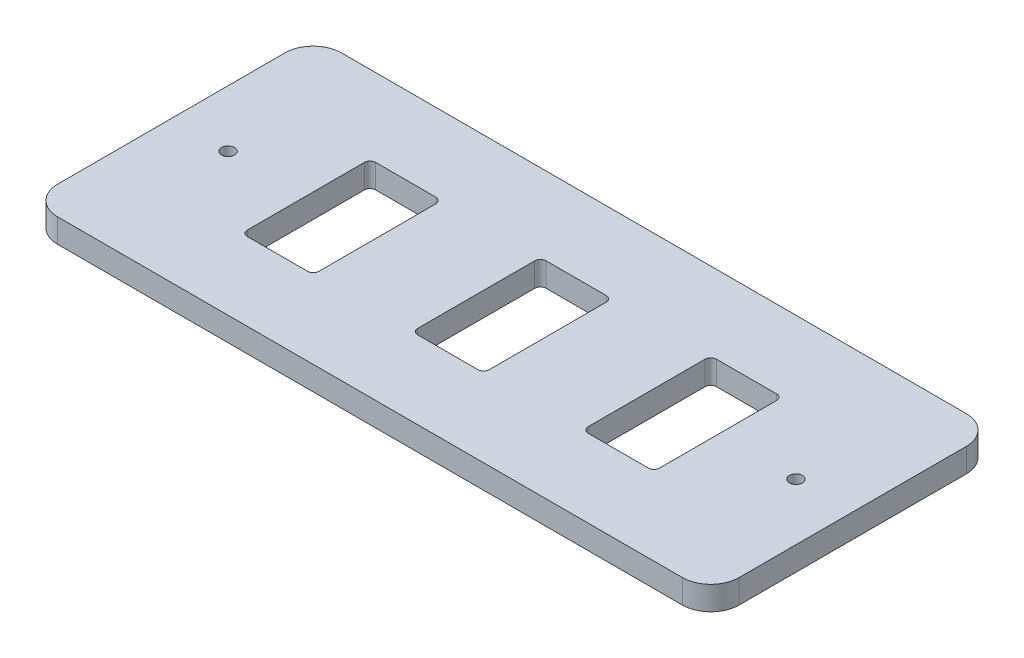
from build123d import *

# Parameters (mm, degrees)
SKETCH1_W           = 152.4
SKETCH1_H           = 63.5
SKETCH1_R           = 1.4605
SKETCH1_W_2         = 16.002
SKETCH1_H_2         = 28.702
BOSS_EXTRUDE1_DEPTH = 2.667
FILLET1_R           = 1.27
FILLET2_R           = 6.35


with BuildPart() as part:
    # Sketch1 → Boss-Extrude1 (new, symmetric)
    with BuildSketch(Plane(origin=(0, 0, 0), x_dir=(1, 0, 0), z_dir=(0, 1, 0))):
        Rectangle(SKETCH1_W, SKETCH1_H)
        with Locations(Location((63.5, 0, 0), (0, 0, 270))):
            Circle(SKETCH1_R, mode=Mode.SUBTRACT)
        with Locations(Location((-63.5, 0, 0), (0, 0, 90))):
            Circle(SKETCH1_R, mode=Mode.SUBTRACT)
        with Locations((-38.1, 0)):
            Rectangle(SKETCH1_W_2, SKETCH1_H_2, mode=Mode.SUBTRACT)
        Rectangle(SKETCH1_W_2, SKETCH1_H_2, mode=Mode.SUBTRACT)
        with Locations((38.1, 0)):
            Rectangle(SKETCH1_W_2, SKETCH1_H_2, mode=Mode.SUBTRACT)
    extrude(amount=BOSS_EXTRUDE1_DEPTH, both=True)

    # Fillet1
    fillet1_edges = [part.edges().sort_by_distance(p)[0] for p in [
        (-30.099, 0, 14.351),
        (-30.099, 0, -14.351),
        (-46.101, 0, -14.351),
        (-46.101, 0, 14.351),
        (8.001, 0, 14.351),
        (8.001, 0, -14.351),
        (-8.001, 0, -14.351),
        (-8.001, 0, 14.351),
        (46.101, 0, 14.351),
        (46.101, 0, -14.351),
        (30.099, 0, -14.351),
        (30.099, 0, 14.351),
    ]]
    fillet(fillet1_edges, radius=FILLET1_R)

    # Fillet2
    fillet2_edges = [part.edges().sort_by_distance(p)[0] for p in [
        (76.2, 0, 31.75),
        (-76.2, 0, 31.75),
        (-76.2, 0, -31.75),
        (76.2, 0, -31.75),
    ]]
    fillet(fillet2_edges, radius=FILLET2_R)


solid = part.part
